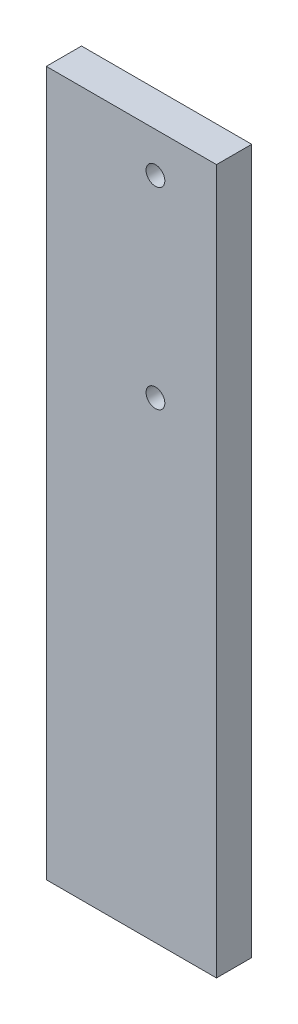
from build123d import *

# Parameters (mm, degrees)
CROQUIS1_W              = 72.48
CROQUIS1_H              = 300
CROQUIS1_R              = 4
SALIENTE_EXTRUIR1_DEPTH = 15


with BuildPart() as part:
    # Croquis1 → Saliente-Extruir1 (new body)
    with BuildSketch(Plane.XY):
        with Locations((36.24, 150)):
            Rectangle(CROQUIS1_W, CROQUIS1_H)
        with Locations((46.48, 283)):
            Circle(CROQUIS1_R, mode=Mode.SUBTRACT)
        with Locations((46.48, 201)):
            Circle(CROQUIS1_R, mode=Mode.SUBTRACT)
    extrude(amount=SALIENTE_EXTRUIR1_DEPTH)


solid = part.part
